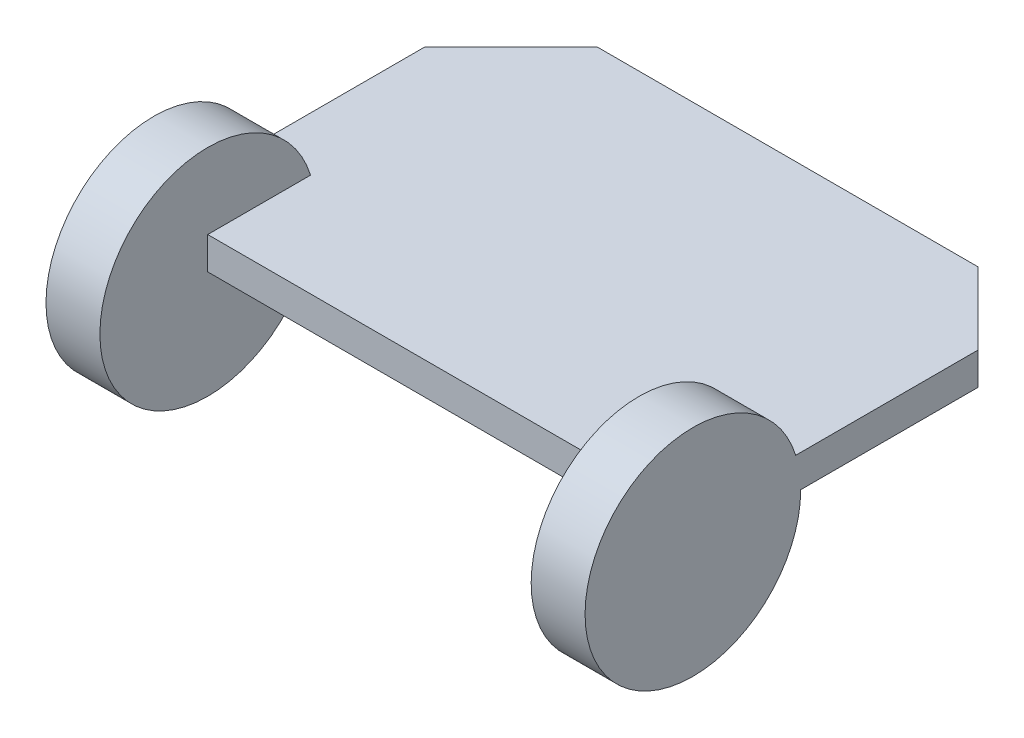
from build123d import *

# Parameters (mm, degrees)
SKETCH12_W          = 5
SKETCH12_H          = 20
BOSS_EXTRUDE3_DEPTH = 3
SKETCH13_R          = 10
BOSS_EXTRUDE4_DEPTH = 5
BOSS_EXTRUDE6_START = -5
SKETCH14_R          = 10
BOSS_EXTRUDE6_DEPTH = 5


with BuildPart() as part:
    # Sketch12 → Boss-Extrude3 (new body)
    with BuildSketch(Plane(origin=(0, 0, 0), x_dir=(1, 0, 0), z_dir=(0, 1, 0))):
        Polygon((7.992304902, 33.129302691), (0, 25.13699779), (0, 20), (5, 20), (5, 0), (45, 0), (45, 20), (50, 20), (50, 26.444694099), (43.315391407, 33.129302691), align=None)
        with Locations((47.5, 10)):
            Rectangle(SKETCH12_W, SKETCH12_H)
        with Locations((2.5, 10)):
            Rectangle(SKETCH12_W, SKETCH12_H)
    extrude(amount=BOSS_EXTRUDE3_DEPTH)

    # Sketch13 → Boss-Extrude4 (add)
    with BuildSketch(Plane.ZY):
        Circle(SKETCH13_R)
    extrude(amount=-BOSS_EXTRUDE4_DEPTH)

    # Sketch14 → Boss-Extrude6 (add)
    with BuildSketch(Plane(origin=(50, 0, 0), x_dir=(0, 0, -1), z_dir=(1, 0, 0)).offset(BOSS_EXTRUDE6_START)):
        Circle(SKETCH14_R)
    extrude(amount=BOSS_EXTRUDE6_DEPTH)


solid = part.part
